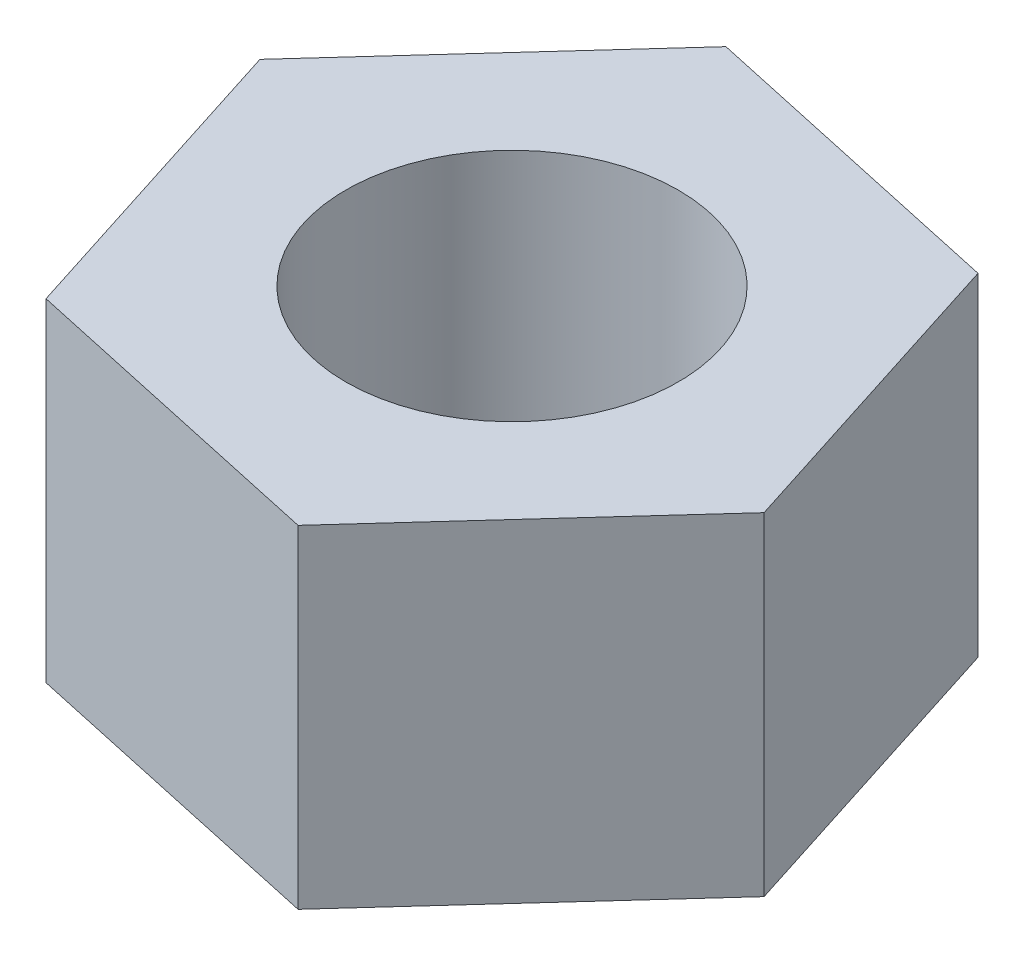
from build123d import *

# Parameters (mm, degrees)
SKETCH1_R           = 1.5
BOSS_EXTRUDE1_DEPTH = 3


with BuildPart() as part:
    # Sketch1 → Boss-Extrude1 (new body)
    with BuildSketch(Plane(origin=(0, 0, 0), x_dir=(1, 0, 0), z_dir=(0, 1, 0))):
        Polygon((0.905038294, -2.834992631), (2.907694785, -0.633710162), (2.002656491, 2.201282469), (-0.905038294, 2.834992631), (-2.907694785, 0.633710162), (-2.002656491, -2.201282469), align=None)
        with Locations(Location((0, 0, 0), (0, 0, 270))):
            Circle(SKETCH1_R, mode=Mode.SUBTRACT)
    extrude(amount=BOSS_EXTRUDE1_DEPTH)


solid = part.part
